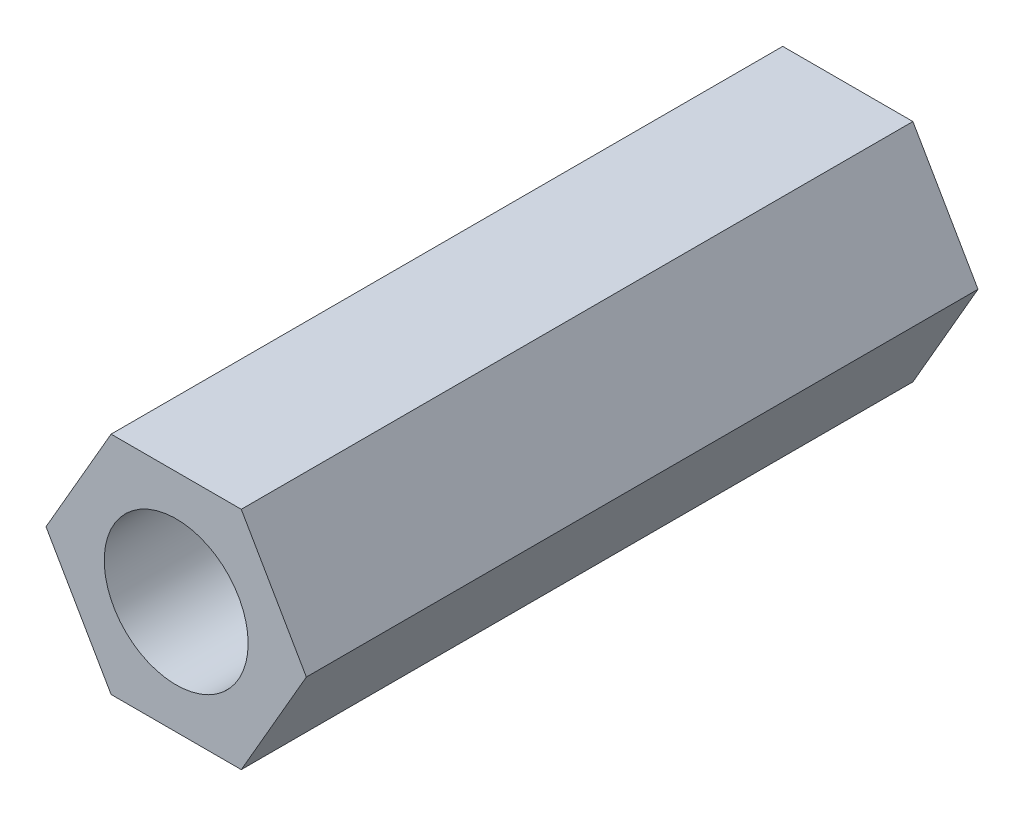
from build123d import *

# Parameters (mm, degrees)
SKETCH_1_R      = 1.5
EXTRUDE_1_DEPTH = 14


with BuildPart() as part:
    # 草图1 → 凸台-拉伸1 (new body)
    with BuildSketch(Plane.XY):
        Polygon((1.356773133, 2.35), (-1.356773133, 2.35), (-2.713546265, 0), (-1.356773133, -2.35), (1.356773133, -2.35), (2.713546265, 0), align=None)
        Circle(SKETCH_1_R, mode=Mode.SUBTRACT)
    extrude(amount=EXTRUDE_1_DEPTH)


solid = part.part
